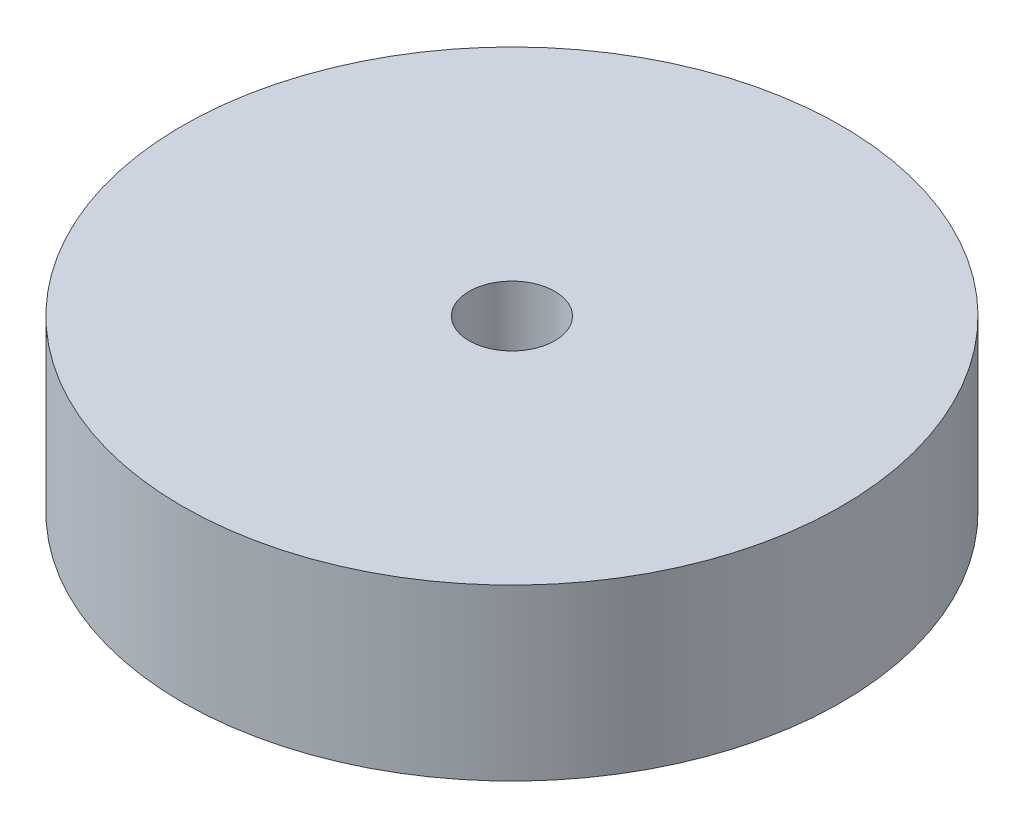
from build123d import *

# Parameters (mm, degrees)
SKETCH1_R           = 200
SKETCH1_R_2         = 26
BOSS_EXTRUDE1_DEPTH = 103


with BuildPart() as part:
    # Sketch1 → Boss-Extrude1 (new body)
    with BuildSketch(Plane(origin=(0, 0, 0), x_dir=(1, 0, 0), z_dir=(0, 1, 0))):
        with Locations(Location((0, 0, 0), (0, 0, 270))):
            Circle(SKETCH1_R)
        with Locations(Location((0, 0, 0), (0, 0, 270))):
            Circle(SKETCH1_R_2, mode=Mode.SUBTRACT)
    extrude(amount=BOSS_EXTRUDE1_DEPTH)


solid = part.part
